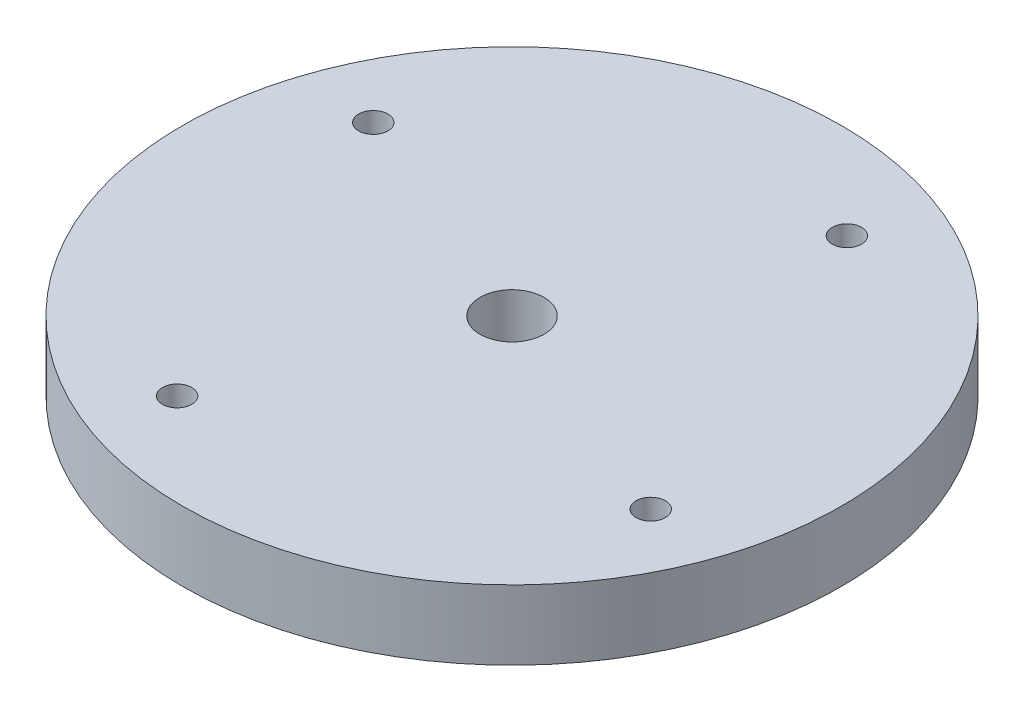
from build123d import *

# Parameters (mm, degrees)
BOSS_EXTRUDE1_DEPTH           = 9.5
BOSS_EXTRUDE1_DEPTH_BACK      = 9.5
SKETCH1_R                     = 90
CSK_FOR_M8_SFHCS2_D           = 17.5
CSK_FOR_M8_SFHCS2_CSINK_D     = 17.92
CSK_FOR_M8_SFHCS2_CSINK_ANGLE = 90
SKETCH8_R                     = 4
CUT_EXTRUDE3_DEPTH            = 128.633263689
CIRPATTERN2_COUNT             = 4


with BuildPart() as part:
    # Sketch1 → Boss-Extrude1 (new, two sides: drawn at the far end of the back side and taken through both)
    with BuildSketch(Plane(origin=(0, 0, 0), x_dir=(1, 0, 0), z_dir=(0, 1, 0)).offset(-BOSS_EXTRUDE1_DEPTH_BACK)):
        Circle(SKETCH1_R)
    extrude(amount=BOSS_EXTRUDE1_DEPTH + BOSS_EXTRUDE1_DEPTH_BACK)

    # CSK for M8 SFHCS2 (through all)
    with Locations(Plane(origin=(0, -9.5, 0), x_dir=(-1, 0, 0), z_dir=(0, -1, 0))):
        with Locations((0, 0)):
            CounterSinkHole(CSK_FOR_M8_SFHCS2_D / 2, CSK_FOR_M8_SFHCS2_CSINK_D / 2, counter_sink_angle=CSK_FOR_M8_SFHCS2_CSINK_ANGLE)

    # Sketch8 → Cut-Extrude3 (cut, symmetric)
    with BuildSketch(Plane(origin=(0, 0, 0), x_dir=(1, 0, 0), z_dir=(0, 1, 0))):
        with Locations((26.787840266, 64.671567276)):
            Circle(SKETCH8_R)
    cut_extrude3 = extrude(amount=CUT_EXTRUDE3_DEPTH, both=True, mode=Mode.SUBTRACT)

    # CirPattern2: Cut-Extrude3 ×4 about axis
    cirpattern2_axis = Axis((0, 9.5, 0), (0, -1, 0))
    for i in range(1, CIRPATTERN2_COUNT):
        add(cut_extrude3.rotate(cirpattern2_axis, i * 360 / CIRPATTERN2_COUNT), mode=Mode.SUBTRACT)


solid = part.part
